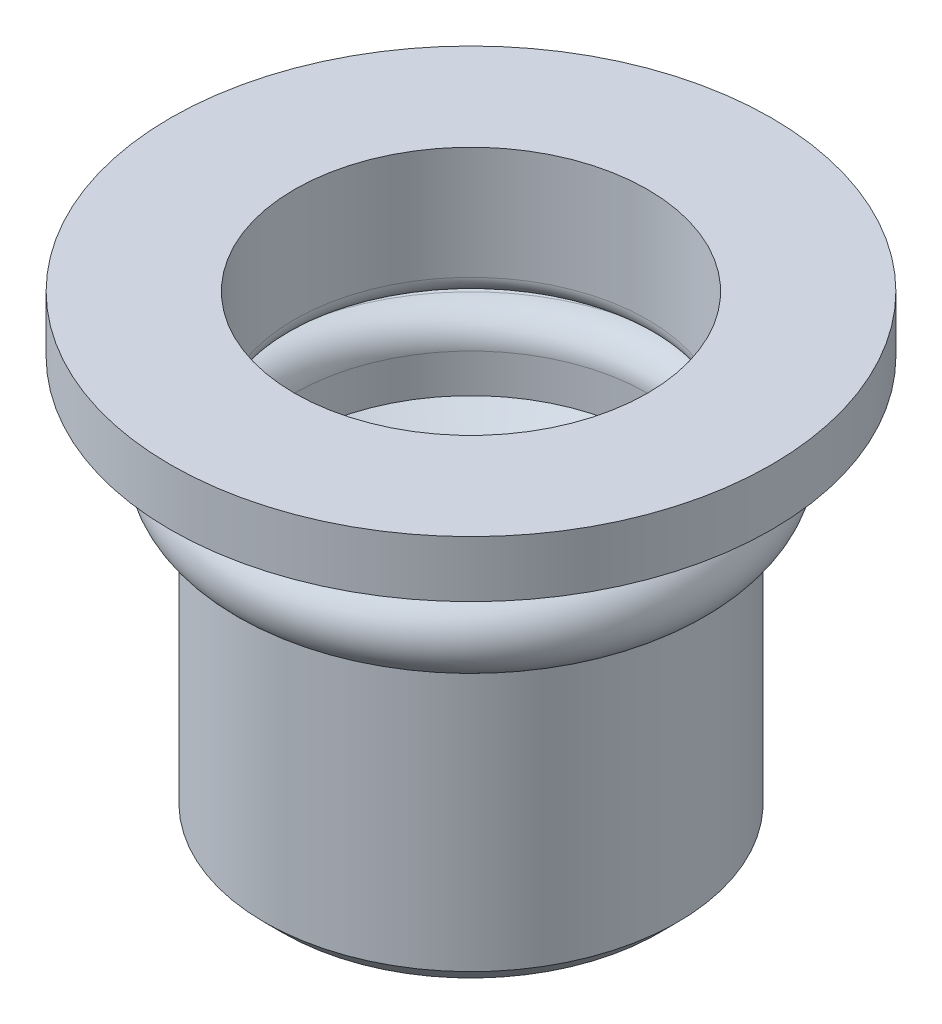
from build123d import *


with BuildPart() as part:
    # Sketch1 → Revolve1 (revolve)
    with BuildSketch(Plane(origin=(0, 0, 0), x_dir=(0, 0, -1), z_dir=(1, 0, 0)), mode=Mode.PRIVATE) as revolve1_sk:
        with BuildLine():
            Line((4.7, 0), (8, 0))
            Line((8, 0), (8, -1.5))
            Line((8, -1.5), (5.5, -1.5))
            Line((5.5, -1.5), (5.5, -2.7))
            ThreePointArc((5.5, -2.7), (6.496497189, -3.61637374), (5.666666667, -4.686013297))
            ThreePointArc((5.666666667, -4.686013297), (5.547247477, -4.754116512), (5.5, -4.883215957))
            Line((5.5, -4.883215957), (5.5, -11.8))
            Line((5.5, -11.8), (5, -12.3))
            Line((5, -12.3), (3.75, -12.3))
            Line((3.75, -12.3), (3.75, -6.3))
            Line((3.75, -6.3), (4.7, -5.729182412))
            Line((4.7, -5.729182412), (4.7, -4.7))
            ThreePointArc((4.7, -4.7), (4.934314575, -4.134314575), (5.5, -3.9))
            ThreePointArc((5.5, -3.9), (5.7, -3.7), (5.5, -3.5))
            Line((5.5, -3.5), (5.2, -3.5))
            ThreePointArc((5.2, -3.5), (4.846446609, -3.353553391), (4.7, -3))
            Line((4.7, -3), (4.7, 0))
        make_face()
    revolve(revolve1_sk.sketch.rotate(Axis((0, 0, 0), (0, -1, 0)), 180), axis=Axis((0, 0, 0), (0, -1, 0)))


solid = part.part
